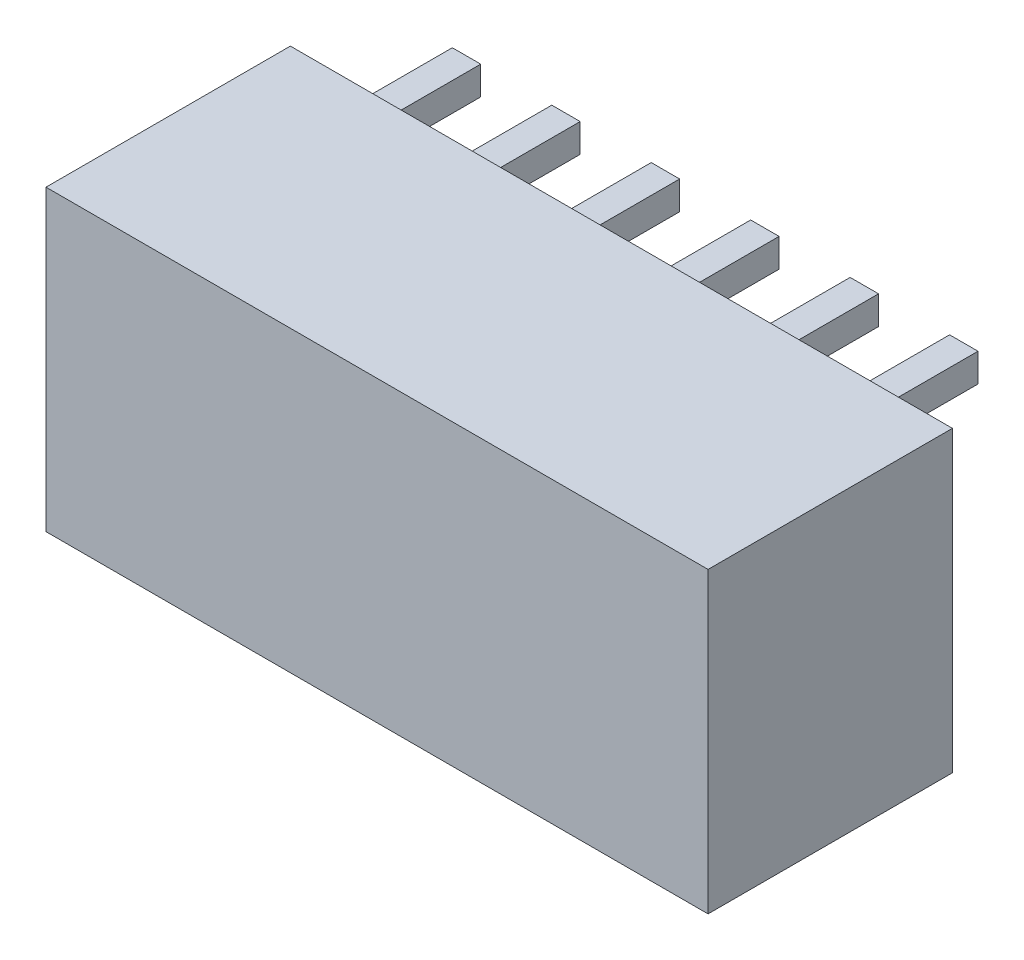
from build123d import *

# Parameters (mm, degrees)
SKETCH_1_W                         = 23.3
SKETCH_1_H                         = 10.5
EXTRUDE_1_DEPTH                    = 8.6
CUT_EXTRUDE_1_DEPTH                = 7
EXTRUDE_START                      = -5
SKETCH_3_W                         = 1
SKETCH_3_H                         = 1
EXTRUDE_2_DEPTH                    = 8.6
CHAMFER_1_SIZE                     = 0.3
PATTERN_LINEAR_1_COUNT             = 6
PATTERN_LINEAR_1_PITCH             = 3.5
CHAMFER_1_OF_PATTERN_LINEAR_1_SIZE = 0.3


with BuildPart() as part:
    # Эскиз1 → Бобышка-Вытянуть1 (new body)
    with BuildSketch(Plane.XY):
        Rectangle(SKETCH_1_W, SKETCH_1_H)
    extrude(amount=EXTRUDE_1_DEPTH)

    # Эскиз2 → Вырез-Вытянуть1 (cut)
    with BuildSketch(Plane.XZ.offset(5.25)):
        Polygon((-10.65, 6.6), (10.65, 6.6), (10.65, 0.2), (8.45, 0.2), (8.45, 1.8), (-6.85, 1.8), (-6.85, 0.2), (-9.05, 0.2), (-9.05, 1.8), (-10.65, 1.8), align=None)
    extrude(amount=-CUT_EXTRUDE_1_DEPTH, mode=Mode.SUBTRACT)

    # Эскиз3 → Бобышка-Вытянуть2 (add)
    with BuildSketch(Plane(origin=(0, 0, 0), x_dir=(-1, 0, 0), z_dir=(0, 0, -1)).offset(EXTRUDE_START)):
        with Locations((8.75, 4.25)):
            Rectangle(SKETCH_3_W, SKETCH_3_H)
    extrude_2 = extrude(amount=EXTRUDE_2_DEPTH)

    # Фаска1
    chamfer_1_edges = [part.edges().sort_by_distance(p)[0] for p in [
        (-8.25, 4.25, -3.6),
        (-8.75, 3.75, -3.6),
        (-9.25, 4.25, -3.6),
        (-8.75, 4.75, -3.6),
    ]]
    chamfer(chamfer_1_edges, length=CHAMFER_1_SIZE)

    # Линейный массив1: Бобышка-Вытянуть2 ×6
    with Locations(*[(i * PATTERN_LINEAR_1_PITCH, 0, 0) for i in range(1, PATTERN_LINEAR_1_COUNT)]):
        add(extrude_2)

    # Фаска1 of Линейный массив1
    chamfer_1_of_pattern_linear_1_edges = [part.edges().sort_by_distance(p)[0] for p in [
        (-4.75, 4.25, -3.6),
        (-5.25, 3.75, -3.6),
        (-5.75, 4.25, -3.6),
        (-5.25, 4.75, -3.6),
        (-1.25, 4.25, -3.6),
        (-1.75, 3.75, -3.6),
        (-2.25, 4.25, -3.6),
        (-1.75, 4.75, -3.6),
        (2.25, 4.25, -3.6),
        (1.75, 3.75, -3.6),
        (1.25, 4.25, -3.6),
        (1.75, 4.75, -3.6),
        (5.75, 4.25, -3.6),
        (5.25, 3.75, -3.6),
        (4.75, 4.25, -3.6),
        (5.25, 4.75, -3.6),
        (9.25, 4.25, -3.6),
        (8.75, 3.75, -3.6),
        (8.25, 4.25, -3.6),
        (8.75, 4.75, -3.6),
    ]]
    chamfer(chamfer_1_of_pattern_linear_1_edges, length=CHAMFER_1_OF_PATTERN_LINEAR_1_SIZE)


solid = part.part
